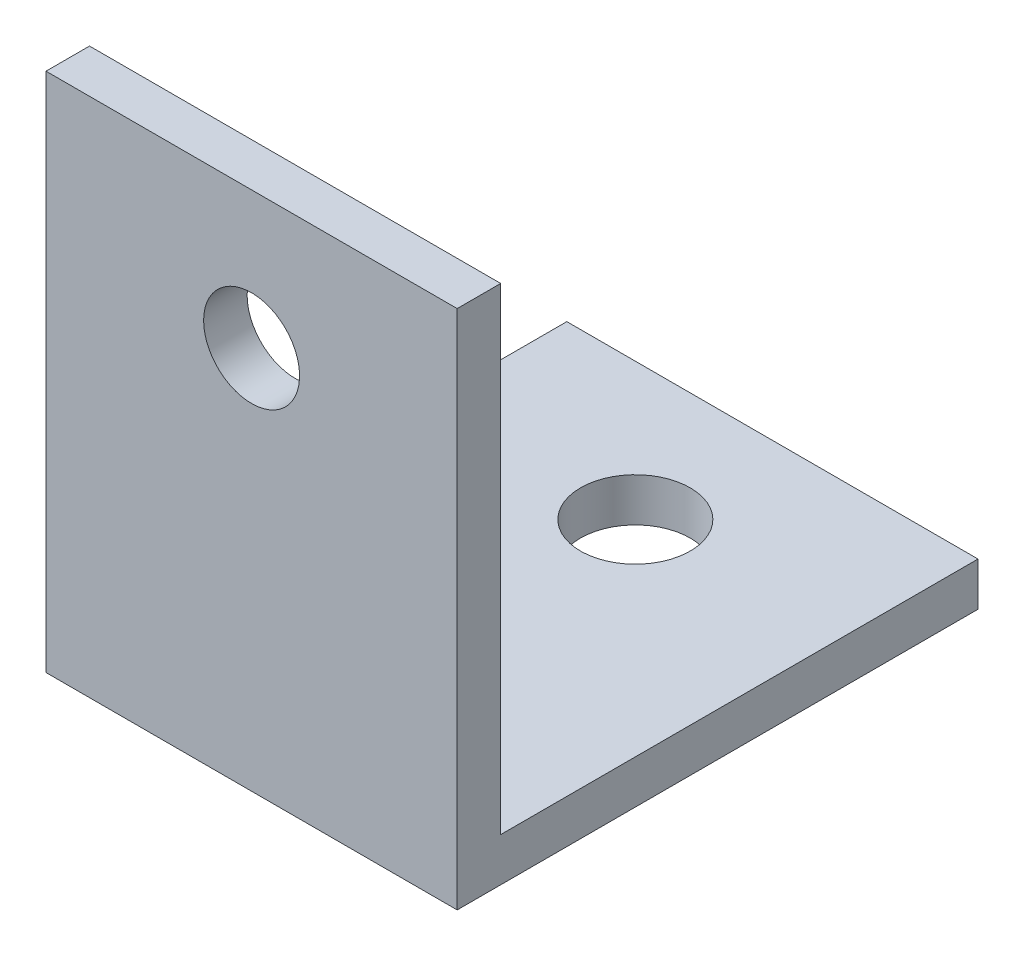
from build123d import *

# Parameters (mm, degrees)
SKETCH1_W               = 30
SKETCH1_H               = 38
BOSS_EXTRUDE1_DEPTH     = 3.175
SKETCH2_W               = 30
SKETCH2_H               = 3.175
BOSS_EXTRUDE2_DEPTH     = 34.825
SKETCH3_R               = 4
CUT_EXTRUDE1_DEPTH      = 60.638751035
SKETCH4_R               = 4
CUT_EXTRUDE2_DEPTH      = 58.667679423
CROQUIS4_R              = 4
CROQUIS4_R_2            = 3.5
SALIENTE_EXTRUIR2_DEPTH = 5
CROQUIS5_W              = 3.979032683
CROQUIS5_H              = 10.100326852
CORTAR_EXTRUIR1_DEPTH   = 36


with BuildPart() as part:
    # Sketch1 → Boss-Extrude1 (new body)
    with BuildSketch(Plane.XY):
        with Locations((15, 19)):
            Rectangle(SKETCH1_W, SKETCH1_H)
    extrude(amount=BOSS_EXTRUDE1_DEPTH)

    # Sketch2 → Boss-Extrude2 (add)
    with BuildSketch(Plane(origin=(0, 0, 0), x_dir=(-1, 0, 0), z_dir=(0, 0, -1))):
        with Locations((-15, 1.5875)):
            Rectangle(SKETCH2_W, SKETCH2_H)
    extrude(amount=BOSS_EXTRUDE2_DEPTH)

    # Sketch3 → Cut-Extrude1 (cut, through all)
    with BuildSketch(Plane(origin=(0, 0, 0), x_dir=(-1, 0, 0), z_dir=(0, 0, -1))):
        with Locations((-15, 28)):
            Circle(SKETCH3_R)
    extrude(amount=-CUT_EXTRUDE1_DEPTH, mode=Mode.SUBTRACT)

    # Sketch4 → Cut-Extrude2 (cut, through all)
    with BuildSketch(Plane(origin=(0, 3.175, 0), x_dir=(1, 0, 0), z_dir=(0, 1, 0))):
        with Locations(Location((15, 24.825, 0), (0, 0, 180))):
            Circle(SKETCH4_R)
    extrude(amount=-CUT_EXTRUDE2_DEPTH, mode=Mode.SUBTRACT)

    # Croquis4 → Saliente-Extruir2 (add)
    with BuildSketch(Plane(origin=(0, 0, 0), x_dir=(-1, 0, 0), z_dir=(0, 0, -1))):
        with Locations((-15, 28)):
            Circle(CROQUIS4_R)
        with Locations((-15, 28)):
            Circle(CROQUIS4_R_2, mode=Mode.SUBTRACT)
    extrude(amount=-SALIENTE_EXTRUIR2_DEPTH)

    # Croquis5 → Cortar-Extruir1 (cut)
    with BuildSketch(Plane.ZY):
        with Locations((5.164516342, 27.585777405)):
            Rectangle(CROQUIS5_W, CROQUIS5_H)
    extrude(amount=-CORTAR_EXTRUIR1_DEPTH, mode=Mode.SUBTRACT)


solid = part.part
